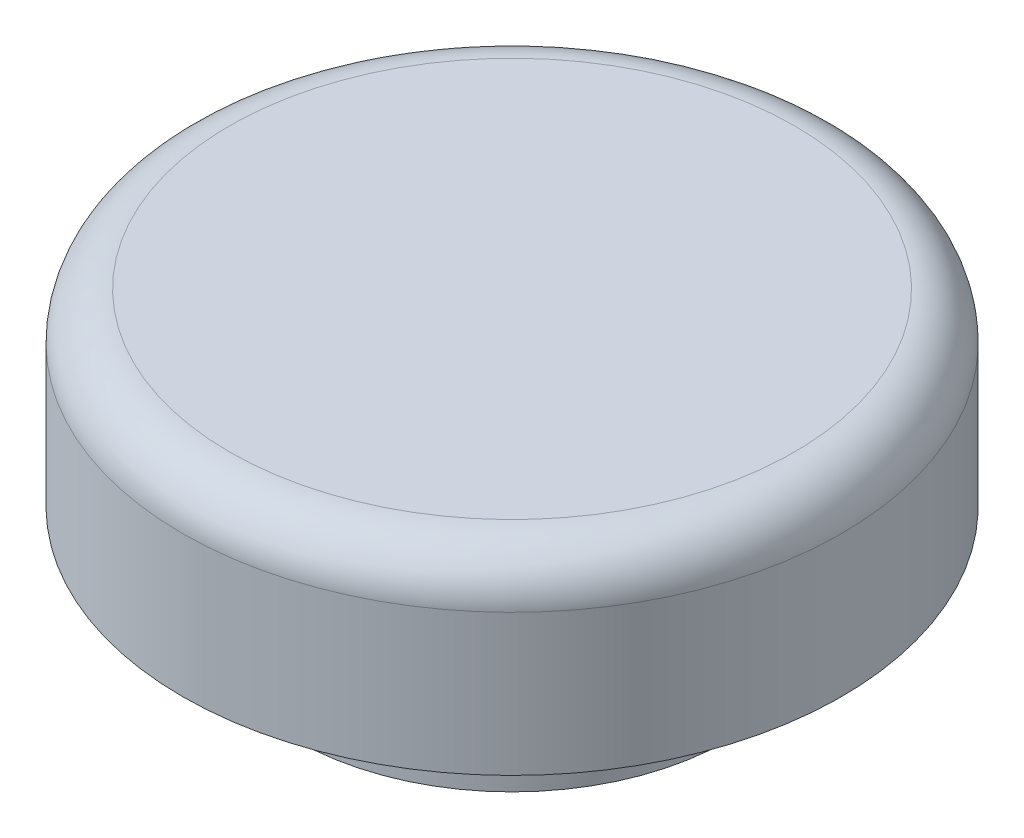
from build123d import *

# Parameters (mm, degrees)
SKETCH_1_R      = 2.3
EXTRUDE_1_DEPTH = 1
SKETCH_2_R      = 3.5
EXTRUDE_2_DEPTH = 2
FILLET_1_R      = 0.5


with BuildPart() as part:
    # 草图1 → 凸台-拉伸1 (new body)
    with BuildSketch(Plane(origin=(0, 0, 0), x_dir=(1, 0, 0), z_dir=(0, 1, 0))):
        with Locations(Location((0, 0, 0), (0, 0, 270))):
            Circle(SKETCH_1_R)
    extrude(amount=EXTRUDE_1_DEPTH)

    # 草图2 → 凸台-拉伸2 (add)
    with BuildSketch(Plane(origin=(0, 1, 0), x_dir=(1, 0, 0), z_dir=(0, 1, 0))):
        with Locations(Location((0, 0, 0), (0, 0, 270))):
            Circle(SKETCH_2_R)
    extrude(amount=EXTRUDE_2_DEPTH)

    # 圆角1
    fillet_1_edges = [part.edges().sort_by_distance(p)[0] for p in [
        (0, 3, -3.5),
    ]]
    fillet(fillet_1_edges, radius=FILLET_1_R)


solid = part.part
